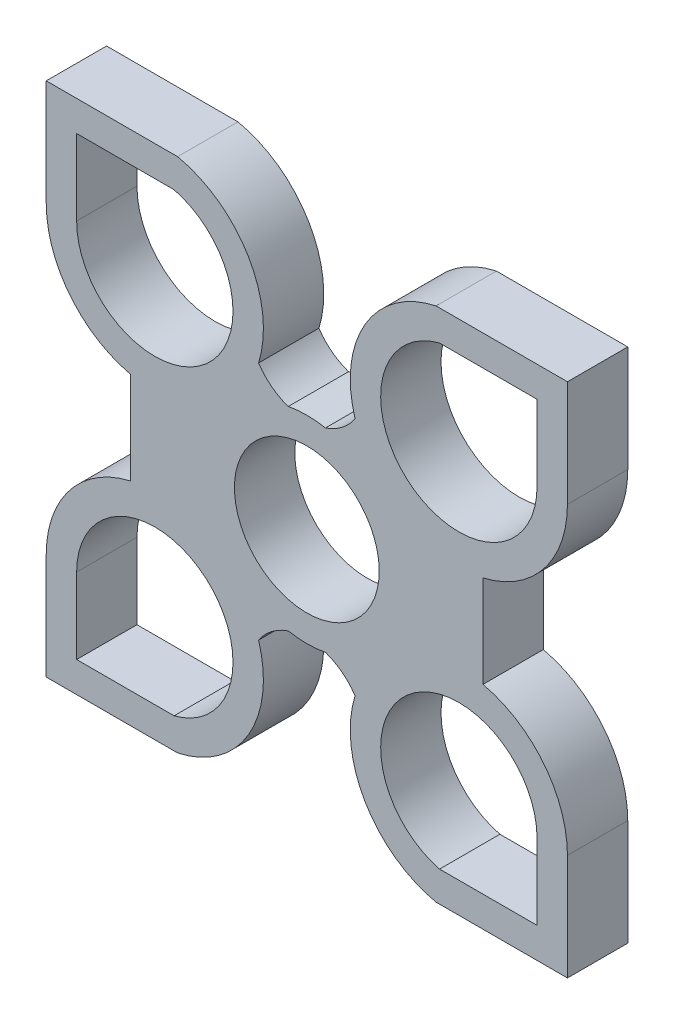
from build123d import *

# Parameters (mm, degrees)
SKETCH1_R           = 30
BOSS_EXTRUDE1_DEPTH = 25


with BuildPart() as part:
    # Sketch1 → Boss-Extrude1 (new body)
    with BuildSketch(Plane.XY):
        with BuildLine():
            ThreePointArc((73, 19.125178063), (98.178118199, 34.937569599), (108, 63))
            Line((108, 63), (108, 107))
            Line((108, 107), (53.566018868, 107))
            ThreePointArc((53.566018868, 107), (24.177408949, 85.755360338), (20, 49.733500839))
            ThreePointArc((20, 49.733500839), (14.637539739, 43.980472393), (7.703238546, 40.26984127))
            ThreePointArc((7.703238546, 40.26984127), (0, 41), (-7.703238546, 40.26984127))
            ThreePointArc((-7.703238546, 40.26984127), (-14.637539739, 43.980472393), (-20, 49.733500839))
            ThreePointArc((-20, 49.733500839), (-24.177408949, 85.755360338), (-53.566018868, 107))
            Line((-53.566018868, 107), (-108, 107))
            Line((-108, 107), (-108, 63))
            ThreePointArc((-108, 63), (-98.178118199, 34.937569599), (-73, 19.125178063))
            Line((-73, 19.125178063), (-73, -19.125178063))
            ThreePointArc((-73, -19.125178063), (-98.178118199, -34.937569599), (-108, -63))
            Line((-108, -63), (-108, -107))
            Line((-108, -107), (-53.566018868, -107))
            ThreePointArc((-53.566018868, -107), (-24.177408949, -85.755360338), (-20, -49.733500839))
            ThreePointArc((-20, -49.733500839), (-14.637539739, -43.980472393), (-7.703238546, -40.26984127))
            ThreePointArc((-7.703238546, -40.26984127), (0, -41), (7.703238546, -40.26984127))
            ThreePointArc((7.703238546, -40.26984127), (14.637539739, -43.980472393), (20, -49.733500839))
            ThreePointArc((20, -49.733500839), (24.177408949, -85.755360338), (53.566018868, -107))
            Line((53.566018868, -107), (108, -107))
            Line((108, -107), (108, -63))
            ThreePointArc((108, -63), (98.178118199, -34.937569599), (73, -19.125178063))
            Line((73, -19.125178063), (73, 19.125178063))
        make_face()
        with BuildLine():
            Line((95.4, -63), (95.4, -94.4))
            Line((95.4, -94.4), (55.012509781, -94.4))
            ThreePointArc((55.012509781, -94.4), (43.113254202, -37.421154413), (95.4, -63))
        make_face(mode=Mode.SUBTRACT)
        with BuildLine():
            ThreePointArc((-55.012509781, 94.4), (-43.113254202, 37.421154413), (-95.4, 63))
            Line((-95.4, 63), (-95.4, 65.547547841))
            Line((-95.4, 65.547547841), (-95.4, 94.4))
            Line((-95.4, 94.4), (-55.012509781, 94.4))
        make_face(mode=Mode.SUBTRACT)
        Circle(SKETCH1_R, mode=Mode.SUBTRACT)
        with BuildLine():
            Line((55.012509781, 94.4), (95.4, 94.4))
            Line((95.4, 94.4), (95.4, 65.547547841))
            Line((95.4, 65.547547841), (95.4, 63))
            ThreePointArc((95.4, 63), (43.113254202, 37.421154413), (55.012509781, 94.4))
        make_face(mode=Mode.SUBTRACT)
        with BuildLine():
            Line((-95.4, -94.4), (-95.4, -63))
            ThreePointArc((-95.4, -63), (-43.113254202, -37.421154413), (-55.012509781, -94.4))
            Line((-55.012509781, -94.4), (-95.4, -94.4))
        make_face(mode=Mode.SUBTRACT)
    extrude(amount=BOSS_EXTRUDE1_DEPTH)


solid = part.part
